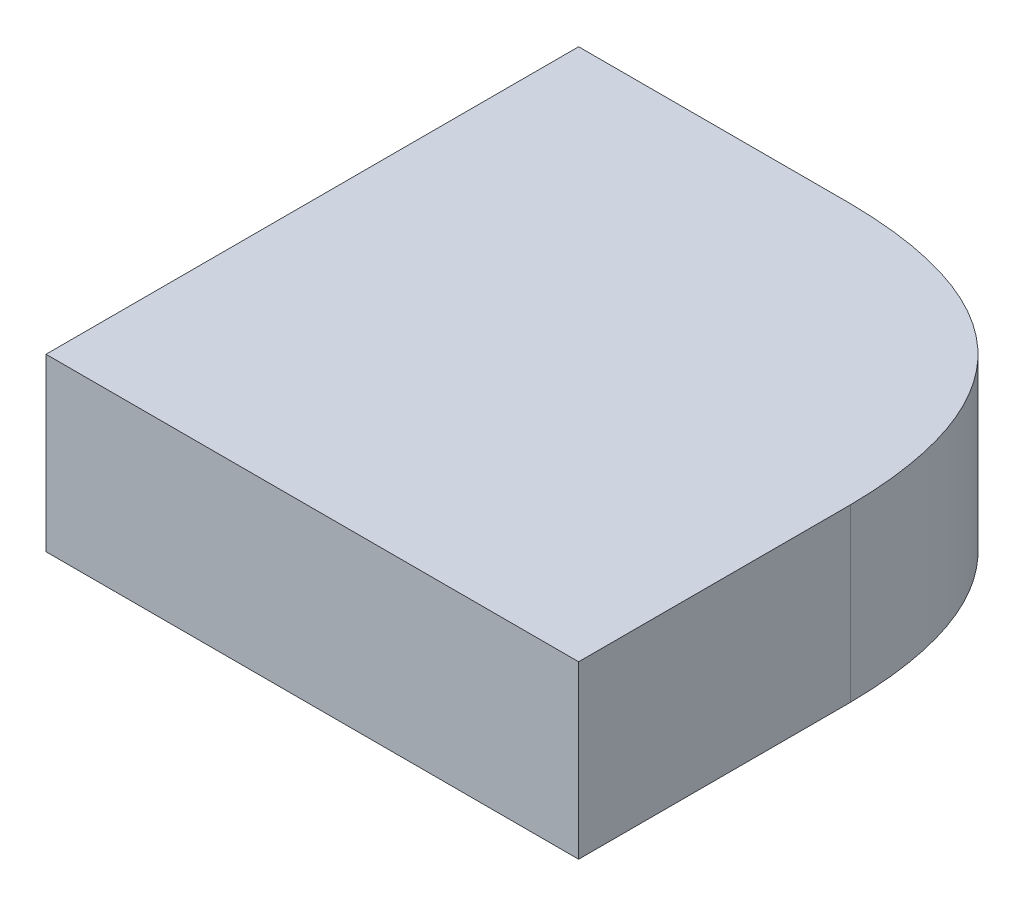
from build123d import *

# Parameters (mm, degrees)
BOSS_EXTRUDE1_DEPTH = 8


with BuildPart() as part:
    # Sketch1 → Boss-Extrude1 (new body)
    with BuildSketch(Plane(origin=(0, 0, 0), x_dir=(1, 0, 0), z_dir=(0, 1, 0))):
        with BuildLine():
            Line((0, 12.455769231), (-12.455769231, 12.455769231))
            Line((-12.455769231, 12.455769231), (-12.455769231, -12.455769231))
            Line((-12.455769231, -12.455769231), (12.455769231, -12.455769231))
            Line((12.455769231, -12.455769231), (12.455769231, 0))
            Line((12.455769231, 0), (12.455769231, 0.254))
            add(Edge.make_bspline(
                [(0.254, 12.455769231), (12.324048116, 12.324048116), (12.455769231, 0.254)],
                knots=[0, 0, 0, 1, 1, 1], degree=2))
            Line((0.254, 12.455769231), (0, 12.455769231))
        make_face()
    extrude(amount=BOSS_EXTRUDE1_DEPTH)


solid = part.part
